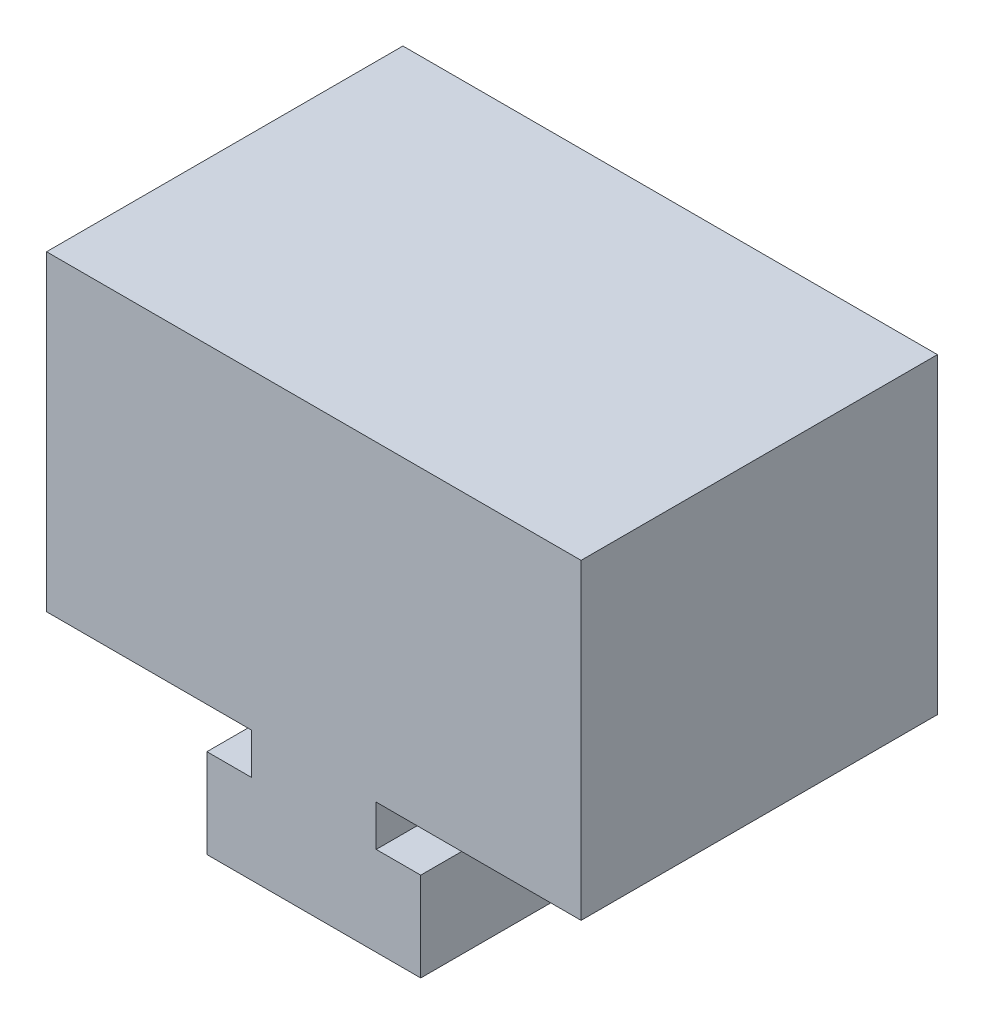
from build123d import *

# Parameters (mm, degrees)
EXTRUDE_1_DEPTH = 20


with BuildPart() as part:
    # 草图1 → 凸台-拉伸1 (new body)
    with BuildSketch(Plane.XY):
        Polygon((-6, -16.05), (6, -16.05), (6, -11.05), (3.5, -11.05), (3.5, -8.75), (15, -8.75), (15, 8.75), (-15, 8.75), (-15, -8.75), (-3.5, -8.75), (-3.5, -11.05), (-6, -11.05), align=None)
    extrude(amount=EXTRUDE_1_DEPTH)


solid = part.part
